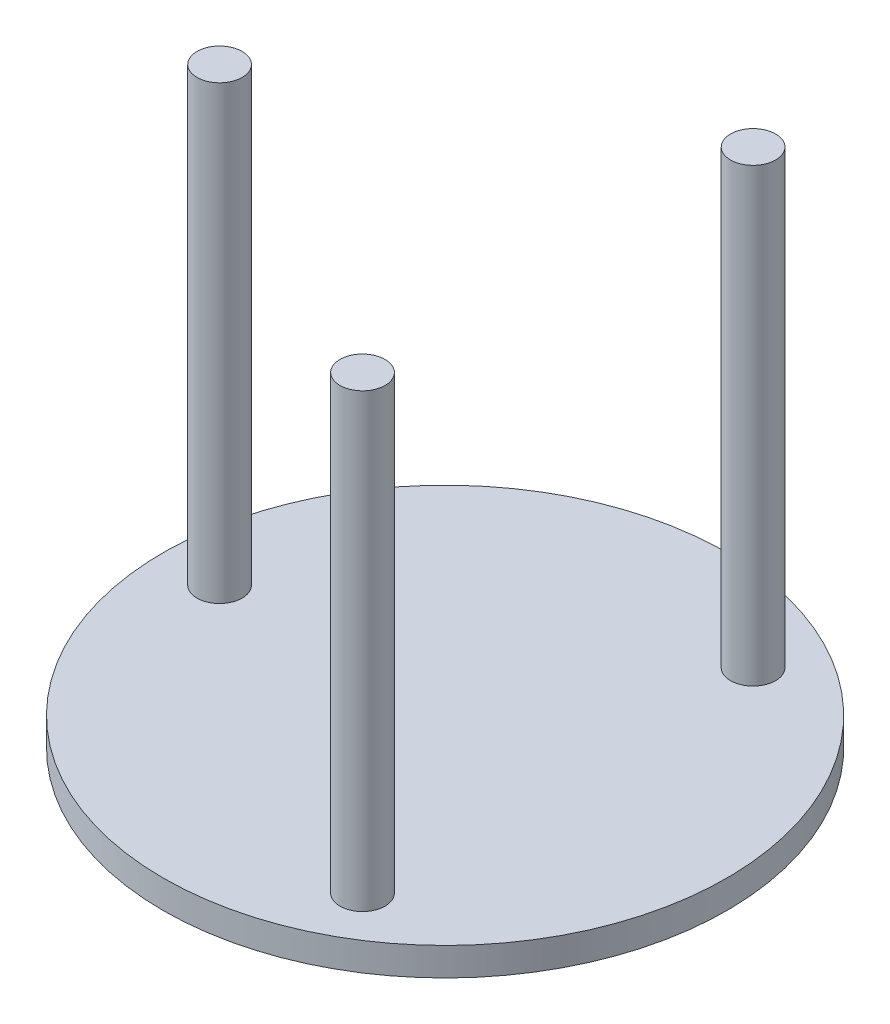
from build123d import *

# Parameters (mm, degrees)
SKETCH1_R           = 50
BOSS_EXTRUDE1_DEPTH = 5
SKETCH2_R           = 4
BOSS_EXTRUDE2_DEPTH = 80


with BuildPart() as part:
    # Sketch1 → Boss-Extrude1 (new body)
    with BuildSketch(Plane(origin=(0, 0, 0), x_dir=(1, 0, 0), z_dir=(0, 1, 0))):
        with Locations(Location((0, 0, 0), (0, 0, 270))):
            Circle(SKETCH1_R)
    extrude(amount=BOSS_EXTRUDE1_DEPTH)

    # Sketch2 → Boss-Extrude2 (add)
    with BuildSketch(Plane(origin=(0, 5, 0), x_dir=(1, 0, 0), z_dir=(0, 1, 0))):
        with Locations(Location((-40, 0, 0), (0, 0, 270))):
            Circle(SKETCH2_R)
        with Locations(Location((20, 34.641016151, 0), (0, 0, 270))):
            Circle(SKETCH2_R)
        with Locations(Location((20, -34.641016151, 0), (0, 0, 270))):
            Circle(SKETCH2_R)
    extrude(amount=BOSS_EXTRUDE2_DEPTH)


solid = part.part
